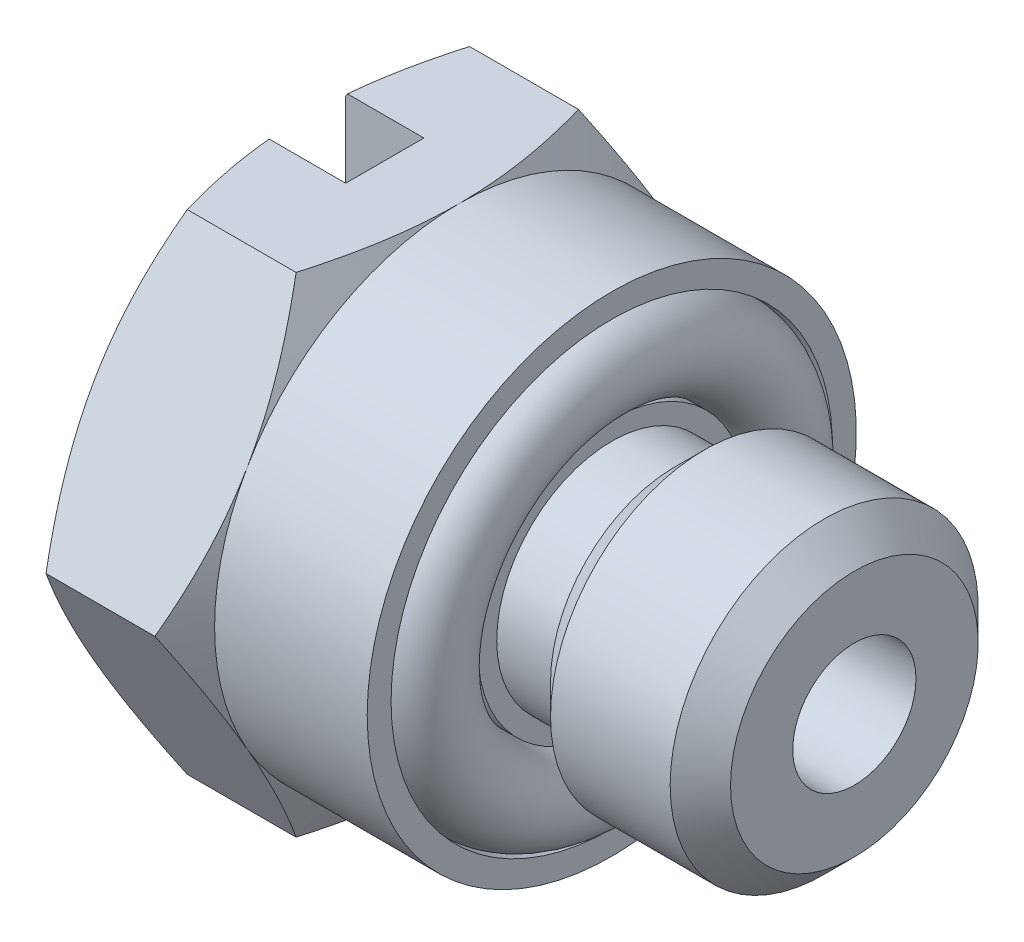
from build123d import *

# Parameters (mm, degrees)
SKETCH3_W                    = 15.875
SKETCH3_H                    = 15.875
CUT_EXTRUDE1_DEPTH           = 4.953
SKETCH4_W                    = 1.27
SKETCH4_H                    = 7.9375
CUT_EXTRUDE2_DEPTH           = 1.27
F_0_6_0_6_DIAMETER_HOLE1_D   = 0.6
F_2_0_2_DIAMETER_HOLE1_D     = 2
F_2_0_2_DIAMETER_HOLE1_DEPTH = 6.84
F_2_0_2_DIAMETER_HOLE1_TIP   = 0.600860619


with BuildPart() as part:
    # Sketch1 → Revolve1 (revolve)
    with BuildSketch(Plane.XY):
        Polygon((-3.937, 0), (-3.937, 1.8669), (-2.921, 1.8669), (-2.921, 2.0095), (-2.43114, 2.49936), (-0.48986, 2.49936), (0, 2.0095), (0, 0), align=None)
    revolve(axis=Axis((0, 0, 0), (-1, 0, 0)))

    # Sketch2 → Revolve2 (revolve)
    with BuildSketch(Plane.XY):
        with BuildLine():
            Line((-8.89, 0), (-8.89, 3.96875))
            Line((-8.89, 3.96875), (-8.126213706, 5.291666667))
            Line((-8.126213706, 5.291666667), (-7.177286294, 5.291666667))
            Line((-7.177286294, 5.291666667), (-6.4135, 3.96875))
            Line((-6.4135, 3.96875), (-3.937, 3.96875))
            Line((-3.937, 3.96875), (-3.937, 3.5814))
            Line((-3.937, 3.5814), (-4.2037, 3.57505))
            ThreePointArc((-4.2037, 3.57505), (-3.505192817, 2.873375), (-4.2037, 2.1717))
            Line((-4.2037, 2.1717), (-3.937, 2.1717))
            Line((-3.937, 2.1717), (-3.937, 0))
            Line((-3.937, 0), (-8.89, 0))
        make_face()
    revolve(axis=Axis((-3.937, 0, 0), (-1, 0, 0)))

    # Sketch3 → Cut-Extrude1 (cut)
    with BuildSketch(Plane(origin=(-8.89, 0, 0), x_dir=(0, 0, -1), z_dir=(1, 0, 0))):
        Rectangle(SKETCH3_W, SKETCH3_H)
        Polygon((-4.582717762, 0), (-2.291358881, -3.96875), (2.291358881, -3.96875), (4.582717762, 0), (2.291358881, 3.96875), (-2.291358881, 3.96875), align=None, mode=Mode.SUBTRACT)
    extrude(amount=CUT_EXTRUDE1_DEPTH, mode=Mode.SUBTRACT)

    # Sketch4 → Cut-Extrude2 (cut)
    with BuildSketch(Plane(origin=(-8.89, 0, 0), x_dir=(0, 0, -1), z_dir=(1, 0, 0))):
        Rectangle(SKETCH4_W, SKETCH4_H)
    extrude(amount=CUT_EXTRUDE2_DEPTH, mode=Mode.SUBTRACT)

    # Ø0.6 (0.6) Diameter Hole1 (through all)
    with Locations(Plane(origin=(0, 0, 0), x_dir=(0, 0, -1), z_dir=(1, 0, 0))):
        with Locations((0, 0)):
            Hole(F_0_6_0_6_DIAMETER_HOLE1_D / 2)

    # Sketch10 → Cut-Revolve2 (revolve, cut)
    with BuildSketch(Plane.XY):
        Polygon((-11.84818619, 1.090543305), (-5.946971863, 0.05), (-5.946971863, 0), (-11.84818619, 0), align=None)
    revolve(axis=Axis((0, 0, 0), (1, 0, 0)), mode=Mode.SUBTRACT)

    # Ø2.0 (2) Diameter Hole1
    with Locations(Plane(origin=(0, 0, 0), x_dir=(0, 0, -1), z_dir=(1, 0, 0))):
        with Locations((0, 0)):
            Hole(F_2_0_2_DIAMETER_HOLE1_D / 2, depth=F_2_0_2_DIAMETER_HOLE1_DEPTH)
            with Locations((0, 0, -(F_2_0_2_DIAMETER_HOLE1_DEPTH + F_2_0_2_DIAMETER_HOLE1_TIP / 2))):  # 118° drill point
                Cone(0, F_2_0_2_DIAMETER_HOLE1_D / 2, F_2_0_2_DIAMETER_HOLE1_TIP, mode=Mode.SUBTRACT)


solid = part.part
